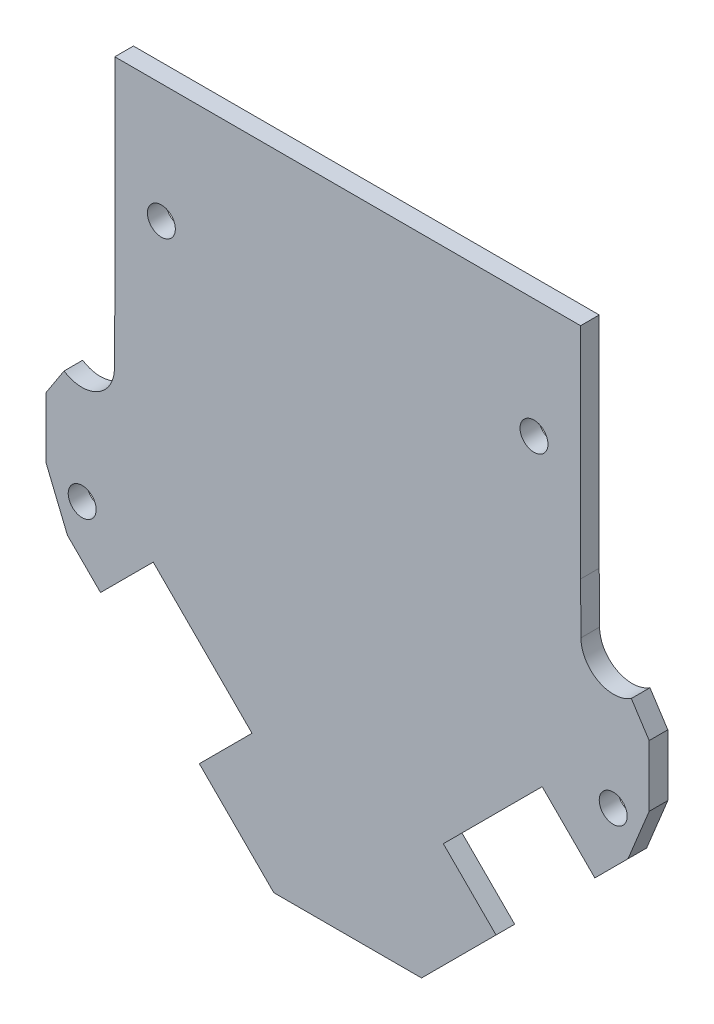
from build123d import *

# Parameters (mm, degrees)
EXTRUDE1_DEPTH  = 2
SKETCH4_R       = 1.5
EXTRUDE3_DEPTH  = 2
EXTRUDE5_DEPTH  = 2
FILLET2_R       = 3
SKETCH7_R       = 1.5
EXTRUDE6_DEPTH  = 2
EXTRUDE7_DEPTH  = 2
EXTRUDE8_DEPTH  = 2
EXTRUDE9_DEPTH  = 2
EXTRUDE10_DEPTH = 2
EXTRUDE11_DEPTH = 2
SKETCH13_W      = 52.444820885
SKETCH13_H      = 24.426279397
EXTRUDE12_DEPTH = 2
SKETCH14_R      = 1.5
EXTRUDE13_DEPTH = 2
EXTRUDE14_DEPTH = 2
EXTRUDE15_DEPTH = 2
SKETCH17_W      = 50
SKETCH17_H      = 4
EXTRUDE17_DEPTH = 2


with BuildPart() as part:
    # Sketch1 → Extrude1 (new body)
    with BuildSketch(Plane.XY):
        Polygon((-15, 13.5), (-15, 38.5), (15, 38.5), (15, 13.5), (26.811651575, -4.688348425), (15, -16.5), (15, -26.5), (7.928932188, -33.571067812), (7.928932188, -52.571067812), (-7.928932188, -52.571067812), (-7.928932188, -33.571067812), (-15, -26.5), (-15, -16.5), (-26.811651575, -4.688348425), align=None)
    extrude(amount=EXTRUDE1_DEPTH)

    # Sketch4 → Extrude3 (add)
    with BuildSketch(Plane.XY.offset(2)):
        Polygon((-26.811651575, -4.688348425), (-32.363678884, -6.963209468), (-30.088817841, -12.515236776), (-22.212122569, -9.287877431), align=None)
        with Locations((-28.5, -8.6)):
            Circle(SKETCH4_R, mode=Mode.SUBTRACT)
    extrude3 = extrude(amount=-EXTRUDE3_DEPTH)

    # Mirror1: Extrude3 across plane
    add(extrude3.mirror(Plane(origin=(0, 0, 0), x_dir=(0, 0, 1), z_dir=(1, 0, 0))))

    # Sketch6 → Extrude5 (add)
    with BuildSketch(Plane.XY.offset(2)):
        Polygon((0, -44.571067812), (-7.928932188, -44.571067812), (-18, -54.642135624), (18, -54.642135624), (7.928932188, -44.571067812), align=None)
    extrude(amount=-EXTRUDE5_DEPTH)

    # Fillet2
    fillet2_edges = [part.edges().sort_by_distance(p)[0] for p in [
        (18, -54.642135624, 1),
        (-18, -54.642135624, 1),
    ]]
    fillet(fillet2_edges, radius=FILLET2_R)

    # Sketch7 → Extrude6 (cut)
    with BuildSketch(Plane.XY.offset(2)):
        with Locations((-11, -52.002135624)):
            Circle(SKETCH7_R)
    extrude6 = extrude(amount=-EXTRUDE6_DEPTH, mode=Mode.SUBTRACT)

    # Mirror4: Extrude6 across plane
    add(extrude6.mirror(Plane(origin=(0, 0, 0), x_dir=(0, 0, 1), z_dir=(1, 0, 0))), mode=Mode.SUBTRACT)

    # Sketch8 → Extrude7 (add)
    with BuildSketch(Plane.XY.offset(2)):
        Polygon((-26.811651575, -4.688348425), (-32.363678884, -6.963209468), (-32.363678884, -0.385171544), (-15, 26.352549211), (-15, 13.5), align=None)
    extrude7 = extrude(amount=-EXTRUDE7_DEPTH)

    # Sketch9 → Extrude8 (add)
    with BuildSketch(Plane.XY.offset(2)):
        Polygon((-22.212122569, -9.287877431), (-25.22165278, -10.520987907), (-15, -20.742640687), (-15, -16.5), align=None)
    extrude8 = extrude(amount=-EXTRUDE8_DEPTH)

    # Sketch10 → Extrude9 (add)
    with BuildSketch(Plane.XY.offset(2)):
        Polygon((-25.22165278, -10.520987907), (-30.088817841, -12.515236776), (-23.702612277, -18.90144234), (-20.271905312, -15.470735375), align=None)
    extrude9 = extrude(amount=-EXTRUDE9_DEPTH)

    # Sketch11 → Extrude10 (add)
    with BuildSketch(Plane.XY.offset(2)):
        Polygon((-15.322157844, -20.420482843), (-18.752864809, -23.851189808), (-7.928932188, -34.675122429), (-7.928932188, -33.571067812), (-15, -26.5), (-15, -20.742640687), align=None)
    extrude10 = extrude(amount=-EXTRUDE10_DEPTH)

    # Sketch12 → Extrude11 (add)
    with BuildSketch(Plane.XY.offset(2)):
        Polygon((-25, 10.953899573), (-25, 38.5), (-15, 38.5), (-15, 26.352549211), align=None)
    extrude11 = extrude(amount=-EXTRUDE11_DEPTH)

    # Mirror5: Extrude7, Extrude8, Extrude9, Extrude10 across plane
    add(extrude7.mirror(Plane(origin=(0, 0, 0), x_dir=(0, 0, 1), z_dir=(1, 0, 0))))
    add(extrude8.mirror(Plane(origin=(0, 0, 0), x_dir=(0, 0, 1), z_dir=(1, 0, 0))))
    add(extrude9.mirror(Plane(origin=(0, 0, 0), x_dir=(0, 0, 1), z_dir=(1, 0, 0))))
    add(extrude10.mirror(Plane(origin=(0, 0, 0), x_dir=(0, 0, 1), z_dir=(1, 0, 0))))

    # Mirror6: Extrude11 across plane
    add(extrude11.mirror(Plane(origin=(0, 0, 0), x_dir=(0, 0, 1), z_dir=(1, 0, 0))))

    # Sketch13 → Extrude12 (cut)
    with BuildSketch(Plane(origin=(0, 0, 0), x_dir=(-1, 0, 0), z_dir=(0, 0, -1))):
        with Locations((1.088066824, -46.888262128)):
            Rectangle(SKETCH13_W, SKETCH13_H)
    extrude(amount=-EXTRUDE12_DEPTH, mode=Mode.SUBTRACT)

    # Sketch14 → Extrude13 (cut)
    with BuildSketch(Plane.XY.offset(2)):
        with Locations((-20, 21.73)):
            Circle(SKETCH14_R)
        with Locations((20, 21.73)):
            Circle(SKETCH14_R)
    extrude(amount=-EXTRUDE13_DEPTH, mode=Mode.SUBTRACT)

    # Sketch15 → Extrude14 (cut)
    with BuildSketch(Plane(origin=(0, 0, 0), x_dir=(-1, 0, 0), z_dir=(0, 0, -1))):
        Polygon((26.531039402, -16.073015215), (20.874185152, -10.416160966), (10.267583435, -21.022762684), (15.924437684, -26.679616933), align=None)
        Polygon((-26.531039402, -16.073015215), (-20.874185152, -10.416160966), (-10.267583435, -21.022762684), (-15.924437684, -26.679616933), align=None)
    extrude(amount=-EXTRUDE14_DEPTH, mode=Mode.SUBTRACT)

    # Sketch16 → Extrude15 (cut)
    with BuildSketch(Plane(origin=(0, 0, 0), x_dir=(-1, 0, 0), z_dir=(0, 0, -1))):
        with BuildLine():
            Line((-25, 10.953899573), (-25.040153728, 5.502540882))
            ThreePointArc((-25.040153728, 5.502540882), (-26.870098067, 2.426680987), (-30.44639035, 2.567193894))
            Line((-30.44639035, 2.567193894), (-25, 10.953899573))
        make_face()
        with BuildLine():
            Line((25, 10.953899573), (25.040153728, 5.502540882))
            ThreePointArc((25.040153728, 5.502540882), (26.870098067, 2.426680987), (30.44639035, 2.567193894))
            Line((30.44639035, 2.567193894), (25, 10.953899573))
        make_face()
    extrude(amount=-EXTRUDE15_DEPTH, mode=Mode.SUBTRACT)

    # Sketch17 → Extrude17 (cut)
    with BuildSketch(Plane(origin=(0, 0, 0), x_dir=(-1, 0, 0), z_dir=(0, 0, -1))):
        with Locations((0, 36.5)):
            Rectangle(SKETCH17_W, SKETCH17_H)
    extrude(amount=-EXTRUDE17_DEPTH, mode=Mode.SUBTRACT)


solid = part.part
